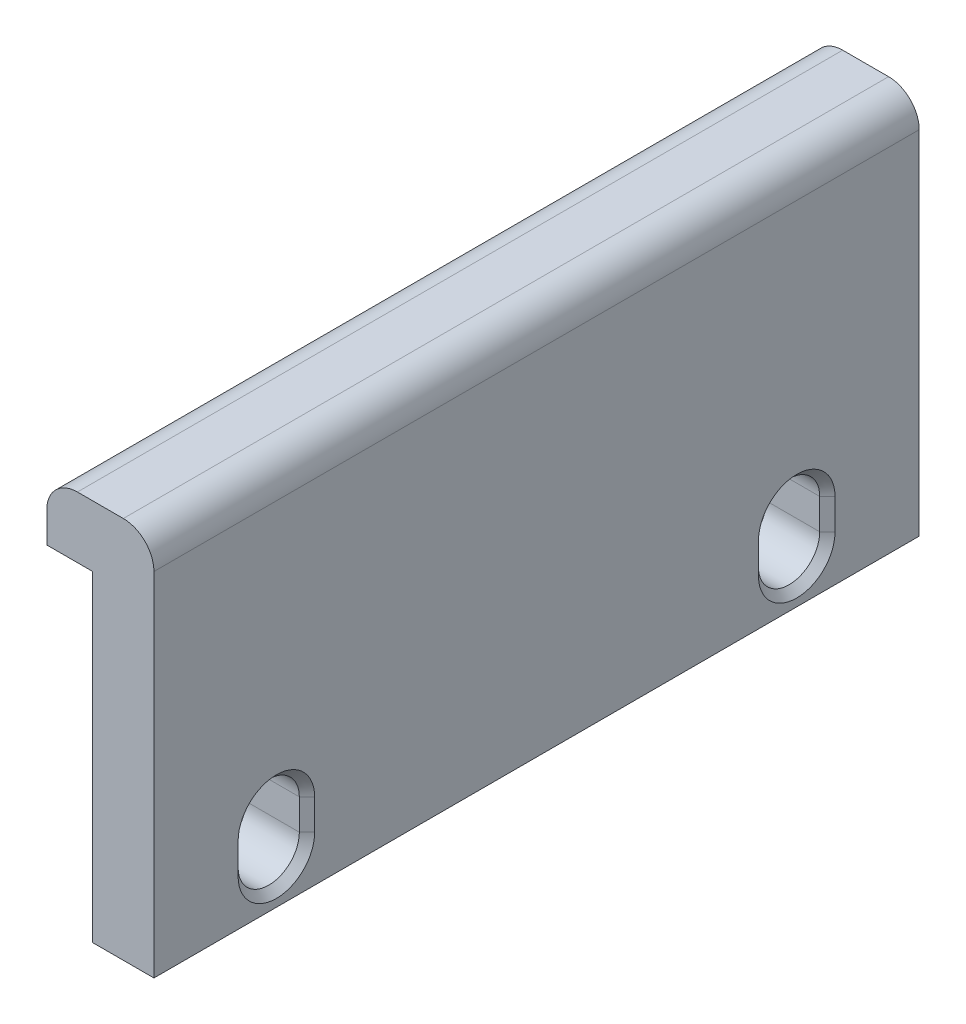
from build123d import *

# Parameters (mm, degrees)
BOSS_EXTRUDE1_DEPTH = 50
FILLET1_R           = 2
CUT_EXTRUDE1_REACH  = 58.338
CHAMFER1_SIZE       = 0.5


with BuildPart() as part:
    # Sketch1 → Boss-Extrude1 (new body)
    with BuildSketch(Plane.XY):
        Polygon((4, 25), (-3, 25), (-3, 21), (0, 21), (0, 0), (4, 0), align=None)
    extrude(amount=BOSS_EXTRUDE1_DEPTH)

    # Fillet1
    fillet1_edges = [part.edges().sort_by_distance(p)[0] for p in [
        (-3, 25, 25),
        (4, 25, 25),
    ]]
    fillet(fillet1_edges, radius=FILLET1_R)

    # Sketch2 → Cut-Extrude1 (cut, up to next)
    with BuildSketch(Plane(origin=(4, 0, 0), x_dir=(0, 0, -1), z_dir=(1, 0, 0)), mode=Mode.PRIVATE) as cut_extrude1_sk1:
        with BuildLine():
            Line((-40, 3), (-40, 5))
            ThreePointArc((-40, 5), (-42, 7), (-44, 5))
            Line((-44, 5), (-44, 3))
            ThreePointArc((-44, 3), (-42, 1), (-40, 3))
        make_face()
    cut_extrude1_tool1 = extrude(cut_extrude1_sk1.sketch, amount=-CUT_EXTRUDE1_REACH, mode=Mode.PRIVATE) & part.part
    # Sketch2 → Cut-Extrude1 (cut, up to next)
    with BuildSketch(Plane(origin=(4, 0, 0), x_dir=(0, 0, -1), z_dir=(1, 0, 0)), mode=Mode.PRIVATE) as cut_extrude1_sk2:
        with BuildLine():
            ThreePointArc((-10, 5), (-8, 7), (-6, 5))
            Line((-6, 5), (-6, 3))
            ThreePointArc((-6, 3), (-8, 1), (-10, 3))
            Line((-10, 3), (-10, 5))
        make_face()
    cut_extrude1_tool2 = extrude(cut_extrude1_sk2.sketch, amount=-CUT_EXTRUDE1_REACH, mode=Mode.PRIVATE) & part.part
    add(cut_extrude1_tool1.solids().sort_by_distance((4, 4, 42))[0], mode=Mode.SUBTRACT)
    add(cut_extrude1_tool2.solids().sort_by_distance((4, 4, 8))[0], mode=Mode.SUBTRACT)

    # Chamfer1
    chamfer1_edges = [part.edges().sort_by_distance(p)[0] for p in [
        (4, 4, 44),
        (4, 4, 40),
        (4, 7, 42),
        (4, 1, 42),
        (4, 7, 8),
        (4, 1, 8),
        (4, 4, 10),
        (4, 4, 6),
    ]]
    chamfer(chamfer1_edges, length=CHAMFER1_SIZE)


solid = part.part
